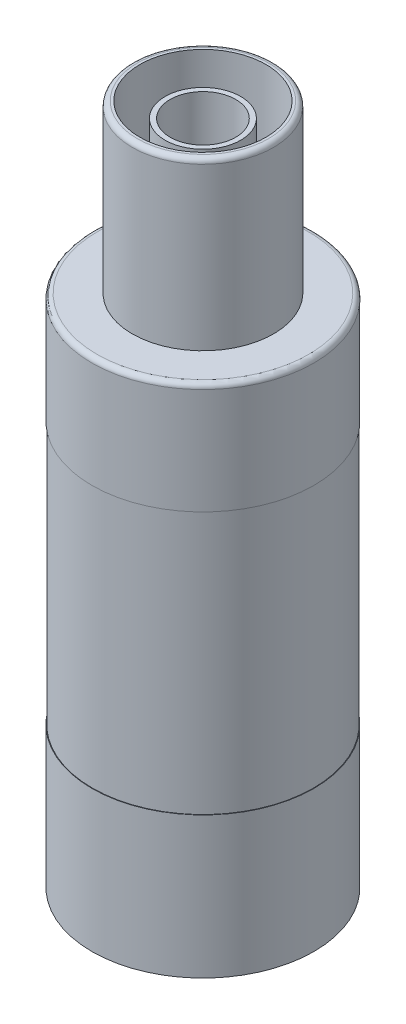
from build123d import *

# Parameters (mm, degrees)
SKETCH_1_R       = 11
EXTRUDE_1_DEPTH  = 14
SKETCH_3_R       = 10.95
SKETCH_3_R_2     = 10.9
EXTRUDE_6_DEPTH  = 26
SKETCH_5_R       = 11
EXTRUDE_7_DEPTH  = 11
SKETCH_6_R       = 7
SKETCH_6_R_2     = 6.25
EXTRUDE_8_DEPTH  = 16.5
SKETCH_6_3_R     = 3.75
SKETCH_6_3_R_2   = 3.25
EXTRUDE_9_DEPTH  = 15
FILLET_1_R       = 0.5
FILLET_2_R       = 0.5
SKETCH_8_R       = 9
EXTRUDE_10_DEPTH = 15
SKETCH_9_R       = 4.762822891
EXTRUDE_11_DEPTH = 15
CHAMFER_1_SIZE   = 4
CHAMFER_1_SIZE2  = 2.800830153


with BuildPart() as part:
    # Эскиз1 → Бобышка-Вытянуть1 (new body)
    with BuildSketch(Plane(origin=(0, 0, 0), x_dir=(1, 0, 0), z_dir=(0, 1, 0))):
        Circle(SKETCH_1_R)
    extrude(amount=EXTRUDE_1_DEPTH)

    # Эскиз3 → Бобышка-Вытянуть6 (add)
    with BuildSketch(Plane(origin=(0, 14, 0), x_dir=(1, 0, 0), z_dir=(0, 1, 0))):
        Circle(SKETCH_3_R)
        Circle(SKETCH_3_R_2, mode=Mode.SUBTRACT)
    extrude(amount=EXTRUDE_6_DEPTH)

    # Эскиз5 → Бобышка-Вытянуть7 (add)
    with BuildSketch(Plane(origin=(0, 40, 0), x_dir=(1, 0, 0), z_dir=(0, 1, 0))):
        Circle(SKETCH_5_R)
    extrude(amount=EXTRUDE_7_DEPTH)

    # Эскиз6 → Бобышка-Вытянуть8 (add)
    with BuildSketch(Plane(origin=(0, 51, 0), x_dir=(1, 0, 0), z_dir=(0, 1, 0))):
        Circle(SKETCH_6_R)
        Circle(SKETCH_6_R_2, mode=Mode.SUBTRACT)
    extrude(amount=EXTRUDE_8_DEPTH)

    # Эскиз6<3> → Бобышка-Вытянуть9 (add)
    with BuildSketch(Plane(origin=(0, 51, 0), x_dir=(1, 0, 0), z_dir=(0, 1, 0))):
        Circle(SKETCH_6_3_R)
        Circle(SKETCH_6_3_R_2, mode=Mode.SUBTRACT)
    extrude(amount=EXTRUDE_9_DEPTH)

    # Скругление1
    fillet_1_edges = [part.edges().sort_by_distance(p)[0] for p in [
        (-11, 51, 0),
    ]]
    fillet(fillet_1_edges, radius=FILLET_1_R)

    # Скругление2
    fillet_2_edges = [part.edges().sort_by_distance(p)[0] for p in [
        (-7, 67.5, 0),
    ]]
    fillet(fillet_2_edges, radius=FILLET_2_R)

    # Эскиз8 → Бобышка-Вытянуть10 (add)
    with BuildSketch(Plane(origin=(0, 14, 0), x_dir=(1, 0, 0), z_dir=(0, 1, 0))):
        Circle(SKETCH_8_R)
    extrude(amount=EXTRUDE_10_DEPTH)

    # Эскиз9 → Бобышка-Вытянуть11 (add)
    with BuildSketch(Plane(origin=(0, 29, 0), x_dir=(1, 0, 0), z_dir=(0, 1, 0))):
        Circle(SKETCH_9_R)
    extrude(amount=EXTRUDE_11_DEPTH)

    # Фаска1
    chamfer_1_edges = [part.edges().sort_by_distance(p)[0] for p in [
        (-4.762822891, 29, 0),
    ]]
    chamfer_1_side = [part.faces().sort_by_distance(p)[0] for p in [
        (-8.745441559, 29, 0),
    ]]
    chamfer(chamfer_1_edges, length=CHAMFER_1_SIZE, length2=CHAMFER_1_SIZE2, reference=chamfer_1_side[0])


solid = part.part
